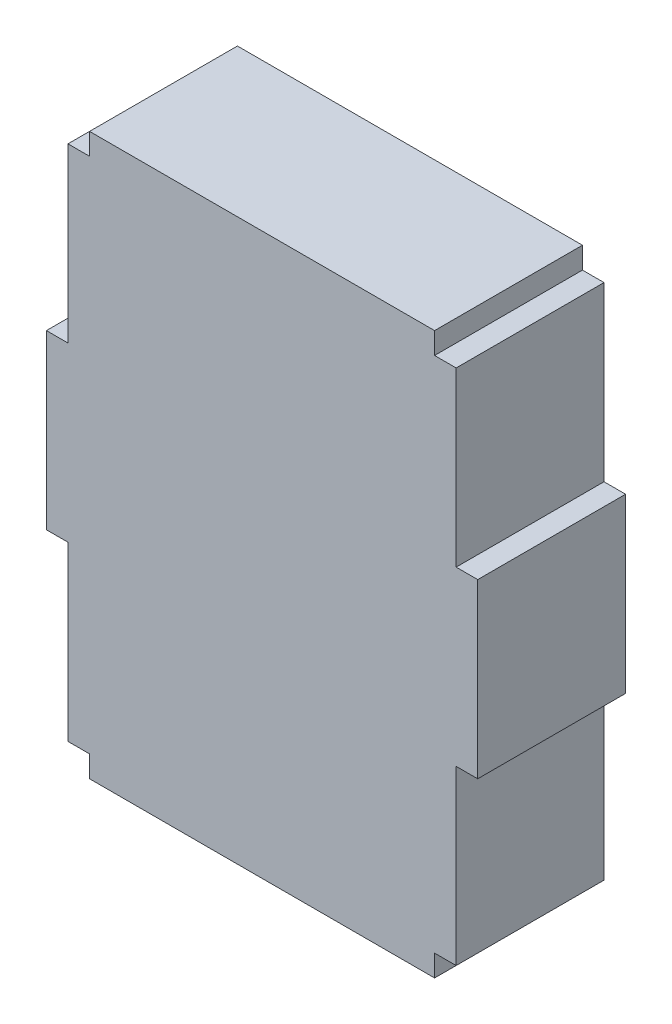
from build123d import *

# Parameters (mm, degrees)
BOSS_EXTRUDE1_DEPTH = 3


with BuildPart() as part:
    # Sketch1 → Boss-Extrude1 (new body)
    with BuildSketch(Plane.XY):
        Polygon((-3.5, 0), (3.5, 0), (3.5, 0.4375), (3.9375, 0.4375), (3.9375, 3.9375), (4.375, 3.9375), (4.375, 7.4375), (3.9375, 7.4375), (3.9375, 10.9375), (3.5, 10.9375), (3.5, 11.375), (-3.5, 11.375), (-3.5, 10.9375), (-3.9375, 10.9375), (-3.9375, 7.4375), (-4.375, 7.4375), (-4.375, 3.9375), (-3.9375, 3.9375), (-3.9375, 0.4375), (-3.5, 0.4375), align=None)
    extrude(amount=BOSS_EXTRUDE1_DEPTH)


solid = part.part
